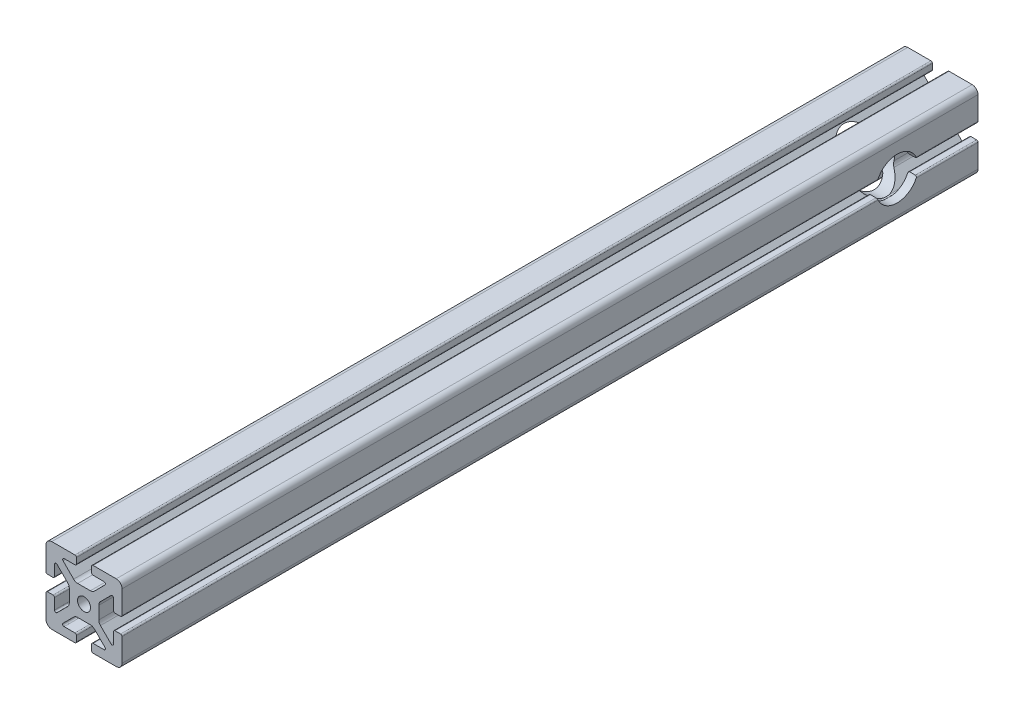
from build123d import *

# Parameters (mm, degrees)
SKETCH1_R          = 3.4036
EXTRUDE1_DEPTH     = 225.11
CUT_EXTRUDE1_REACH = 231.509
SKETCH2_R          = 11.1125


with BuildPart() as part:
    # Sketch1 → Extrude1 (new, symmetric)
    with BuildSketch(Plane.XY):
        with BuildLine():
            Line((-20, 16.952), (-20, 4.7625))
            ThreePointArc((-20, 4.7625), (-19.776815367, 4.223684633), (-19.238, 4.0005))
            Line((-19.238, 4.0005), (-16.2662, 4.0005))
            ThreePointArc((-16.2662, 4.0005), (-15.727384633, 4.223684633), (-15.5042, 4.7625))
            Line((-15.5042, 4.7625), (-15.5042, 10.485558599))
            ThreePointArc((-15.5042, 10.485558599), (-15.033804775, 11.189554802), (-14.203384633, 11.024373966))
            Line((-14.203384633, 11.024373966), (-8.635059555, 5.456048889))
            ThreePointArc((-8.635059555, 5.456048889), (-7.985348265, 4.483687227), (-7.7572, 3.336708444))
            Line((-7.7572, 3.336708444), (-7.7572, -3.336708444))
            ThreePointArc((-7.7572, -3.336708444), (-7.985348265, -4.483687227), (-8.635059555, -5.456048889))
            Line((-8.635059555, -5.456048889), (-14.203384633, -11.024373966))
            ThreePointArc((-14.203384633, -11.024373966), (-15.033804775, -11.189554802), (-15.5042, -10.485558599))
            Line((-15.5042, -10.485558599), (-15.5042, -4.7625))
            ThreePointArc((-15.5042, -4.7625), (-15.727384633, -4.223684633), (-16.2662, -4.0005))
            Line((-16.2662, -4.0005), (-19.238, -4.0005))
            ThreePointArc((-19.238, -4.0005), (-19.776815367, -4.223684633), (-20, -4.7625))
            Line((-20, -4.7625), (-20, -16.952))
            ThreePointArc((-20, -16.952), (-19.107261469, -19.107261469), (-16.952, -20))
            Line((-16.952, -20), (-4.7625, -20))
            ThreePointArc((-4.7625, -20), (-4.223684633, -19.776815367), (-4.0005, -19.238))
            Line((-4.0005, -19.238), (-4.0005, -16.2662))
            ThreePointArc((-4.0005, -16.2662), (-4.223684633, -15.727384633), (-4.7625, -15.5042))
            Line((-4.7625, -15.5042), (-10.485558599, -15.5042))
            ThreePointArc((-10.485558599, -15.5042), (-11.189554802, -15.033804775), (-11.024373966, -14.203384633))
            Line((-11.024373966, -14.203384633), (-5.456048889, -8.635059555))
            ThreePointArc((-5.456048889, -8.635059555), (-4.483687227, -7.985348265), (-3.336708444, -7.7572))
            Line((-3.336708444, -7.7572), (3.336708444, -7.7572))
            ThreePointArc((3.336708444, -7.7572), (4.483687227, -7.985348265), (5.456048889, -8.635059555))
            Line((5.456048889, -8.635059555), (11.024373966, -14.203384633))
            ThreePointArc((11.024373966, -14.203384633), (11.189554802, -15.033804775), (10.485558599, -15.5042))
            Line((10.485558599, -15.5042), (4.7625, -15.5042))
            ThreePointArc((4.7625, -15.5042), (4.223684633, -15.727384633), (4.0005, -16.2662))
            Line((4.0005, -16.2662), (4.0005, -19.238))
            ThreePointArc((4.0005, -19.238), (4.223684633, -19.776815367), (4.7625, -20))
            Line((4.7625, -20), (16.952, -20))
            ThreePointArc((16.952, -20), (19.107261469, -19.107261469), (20, -16.952))
            Line((20, -16.952), (20, -4.7625))
            ThreePointArc((20, -4.7625), (19.776815367, -4.223684633), (19.238, -4.0005))
            Line((19.238, -4.0005), (16.2662, -4.0005))
            ThreePointArc((16.2662, -4.0005), (15.727384633, -4.223684633), (15.5042, -4.7625))
            Line((15.5042, -4.7625), (15.5042, -10.485558599))
            ThreePointArc((15.5042, -10.485558599), (15.033804775, -11.189554802), (14.203384633, -11.024373966))
            Line((14.203384633, -11.024373966), (8.635059555, -5.456048889))
            ThreePointArc((8.635059555, -5.456048889), (7.985348265, -4.483687227), (7.7572, -3.336708444))
            Line((7.7572, -3.336708444), (7.7572, 3.336708444))
            ThreePointArc((7.7572, 3.336708444), (7.985348265, 4.483687227), (8.635059555, 5.456048889))
            Line((8.635059555, 5.456048889), (14.203384633, 11.024373966))
            ThreePointArc((14.203384633, 11.024373966), (15.033804775, 11.189554802), (15.5042, 10.485558599))
            Line((15.5042, 10.485558599), (15.5042, 4.7625))
            ThreePointArc((15.5042, 4.7625), (15.727384633, 4.223684633), (16.2662, 4.0005))
            Line((16.2662, 4.0005), (19.238, 4.0005))
            ThreePointArc((19.238, 4.0005), (19.776815367, 4.223684633), (20, 4.7625))
            Line((20, 4.7625), (20, 16.952))
            ThreePointArc((20, 16.952), (19.107261469, 19.107261469), (16.952, 20))
            Line((16.952, 20), (4.7625, 20))
            ThreePointArc((4.7625, 20), (4.223684633, 19.776815367), (4.0005, 19.238))
            Line((4.0005, 19.238), (4.0005, 16.2662))
            ThreePointArc((4.0005, 16.2662), (4.223684633, 15.727384633), (4.7625, 15.5042))
            Line((4.7625, 15.5042), (10.485558599, 15.5042))
            ThreePointArc((10.485558599, 15.5042), (11.189554802, 15.033804775), (11.024373966, 14.203384633))
            Line((11.024373966, 14.203384633), (5.456048889, 8.635059555))
            ThreePointArc((5.456048889, 8.635059555), (4.483687227, 7.985348265), (3.336708444, 7.7572))
            Line((3.336708444, 7.7572), (-3.336708444, 7.7572))
            ThreePointArc((-3.336708444, 7.7572), (-4.483687227, 7.985348265), (-5.456048889, 8.635059555))
            Line((-5.456048889, 8.635059555), (-11.024373966, 14.203384633))
            ThreePointArc((-11.024373966, 14.203384633), (-11.189554802, 15.033804775), (-10.485558599, 15.5042))
            Line((-10.485558599, 15.5042), (-4.7625, 15.5042))
            ThreePointArc((-4.7625, 15.5042), (-4.223684633, 15.727384633), (-4.0005, 16.2662))
            Line((-4.0005, 16.2662), (-4.0005, 19.238))
            ThreePointArc((-4.0005, 19.238), (-4.223684633, 19.776815367), (-4.7625, 20))
            Line((-4.7625, 20), (-16.952, 20))
            ThreePointArc((-16.952, 20), (-19.107261469, 19.107261469), (-20, 16.952))
        make_face()
        with Locations(Location((0, 0, 0), (0, 0, 180))):
            Circle(SKETCH1_R, mode=Mode.SUBTRACT)
    extrude(amount=EXTRUDE1_DEPTH, both=True)

    # Cut-Extrude1: up to this face of the body (flat: up to its plane)
    cut_extrude1_end = Plane(part.part.faces().sort_by_distance((-20, 10.85725, 0))[0])
    # Sketch2 → Cut-Extrude1 (cut, up to the picked face)
    with BuildSketch(Plane(origin=(20, 0, 0), x_dir=(0, 0, -1), z_dir=(1, 0, 0)), mode=Mode.PRIVATE) as cut_extrude1_sk1:
        with Locations(Location((182.565, 0, 0), (0, 0, 342.526405988))):
            Circle(SKETCH2_R)
    cut_extrude1_tool1 = split(extrude(cut_extrude1_sk1.sketch, amount=-CUT_EXTRUDE1_REACH, mode=Mode.PRIVATE), bisect_by=cut_extrude1_end, keep=Keep.BOTH, mode=Mode.PRIVATE)
    add(cut_extrude1_tool1.solids().sort_by(Axis((20, 0, -182.565), (-1, 0, 0)))[0], mode=Mode.SUBTRACT)


solid = part.part
